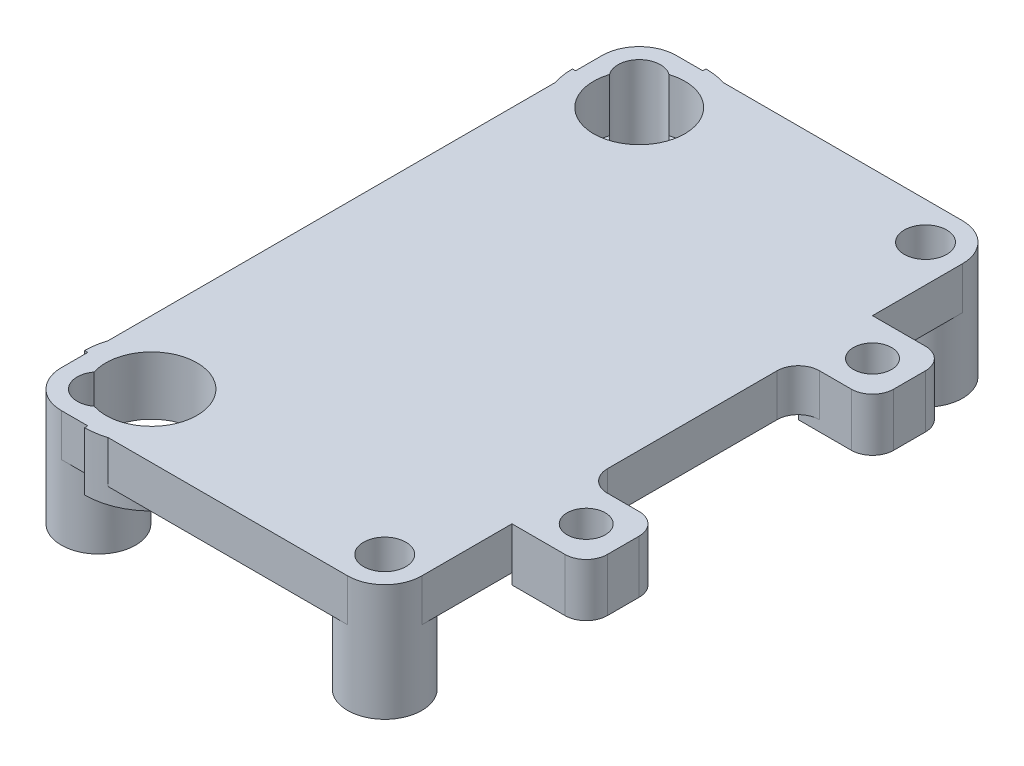
from build123d import *

# Parameters (mm, degrees)
SKETCH1_R                       = 3.5
BOSS_EXTRUDE1_DEPTH             = 11
BOSS_EXTRUDE1_2_DEPTH           = 11
BOSS_EXTRUDE1_3_DEPTH           = 11
BOSS_EXTRUDE1_4_DEPTH           = 11
BOSS_EXTRUDE2_START             = -1
BOSS_EXTRUDE2_DEPTH             = 1
F_4_0MM_DOWEL_HOLE1_D           = 4
BOSS_EXTRUDE3_START             = 3
BOSS_EXTRUDE3_DEPTH             = 3
BOSS_EXTRUDE4_REACH             = 64.845
SKETCH11_W                      = 7
SKETCH11_H                      = 7
BOSS_EXTRUDE4_DIRECTION_2_DEPTH = 1
FILLET1_R                       = 2
M3_CLEARANCE_HOLE1_D            = 3.6
SKETCH15_R                      = 4.3
CUT_EXTRUDE1_DEPTH              = 5
BOSS_EXTRUDE6_START             = -1
BOSS_EXTRUDE6_DEPTH             = 5.5


with BuildPart() as part:
    # Sketch1 → Boss-Extrude1 (new body)
    with BuildSketch(Plane(origin=(0, 0, 0), x_dir=(1, 0, 0), z_dir=(0, 1, 0))):
        with Locations(Location((0, 51, 0), (0, 0, 270))):
            Circle(SKETCH1_R)
    extrude(amount=BOSS_EXTRUDE1_DEPTH)



with BuildPart() as body_2:
    # Sketch1 → Boss-Extrude1 2 (new body)
    with BuildSketch(Plane(origin=(0, 0, 0), x_dir=(1, 0, 0), z_dir=(0, 1, 0))):
        with Locations(Location((27, 51, 0), (0, 0, 270))):
            Circle(SKETCH1_R)
    extrude(amount=BOSS_EXTRUDE1_2_DEPTH)


with BuildPart() as body_3:
    # Sketch1 → Boss-Extrude1 3 (new body)
    with BuildSketch(Plane(origin=(0, 0, 0), x_dir=(1, 0, 0), z_dir=(0, 1, 0))):
        with Locations(Location((27, 0, 0), (0, 0, 270))):
            Circle(SKETCH1_R)
    extrude(amount=BOSS_EXTRUDE1_3_DEPTH)


with BuildPart() as body_4:
    # Sketch1 → Boss-Extrude1 4 (new body)
    with BuildSketch(Plane(origin=(0, 0, 0), x_dir=(1, 0, 0), z_dir=(0, 1, 0))):
        with Locations(Location((0, 0, 0), (0, 0, 270))):
            Circle(SKETCH1_R)
    extrude(amount=BOSS_EXTRUDE1_4_DEPTH)


with BuildPart() as part_1:
    add(part.part)

    add(body_2.part)  # Boss-Extrude2 merges body 2

    add(body_3.part)  # Boss-Extrude2 merges body 3

    add(body_4.part)  # Boss-Extrude2 merges body 4
    # Sketch2 → Boss-Extrude2 (add)
    with BuildSketch(Plane(origin=(0, 11, 0), x_dir=(1, 0, 0), z_dir=(0, 1, 0)).offset(BOSS_EXTRUDE2_START)):
        with BuildLine():
            Line((27, 54.5), (0, 54.5))
            ThreePointArc((0, 54.5), (-2.474873734, 53.474873734), (-3.5, 51))
            Line((-3.5, 51), (-3.5, 0))
            ThreePointArc((-3.5, 0), (-2.474873734, -2.474873734), (0, -3.5))
            Line((0, -3.5), (27, -3.5))
            ThreePointArc((27, -3.5), (29.474873734, -2.474873734), (30.5, 0))
            Line((30.5, 0), (30.5, 51))
            ThreePointArc((30.5, 51), (29.474873734, 53.474873734), (27, 54.5))
        make_face()
    extrude(amount=BOSS_EXTRUDE2_DEPTH)

    # Ø4.0mm Dowel Hole1 (through all)
    with Locations(Plane(origin=(0, 0, 0), x_dir=(-1, 0, 0), z_dir=(0, -1, 0))):
        with Locations((-27, 51), (0, 51), (0, 0), (-27, 0)):
            Hole(F_4_0MM_DOWEL_HOLE1_D / 2)

    # Sketch10 → Boss-Extrude3 (add)
    with BuildSketch(Plane.XZ.offset(-10).offset(BOSS_EXTRUDE3_START)):
        with BuildLine():
            ThreePointArc((-3.5, -51), (-2.958039892, -49.129171307), (-1.5, -47.83772234))
            Line((-1.5, -47.83772234), (-1.5, -3.16227766))
            ThreePointArc((-1.5, -3.16227766), (-2.958039892, -1.870828693), (-3.5, 0))
            Line((-3.5, 0), (-3.5, -51))
        make_face()
        with BuildLine():
            Line((3.16227766, 1.5), (23.83772234, 1.5))
            ThreePointArc((23.83772234, 1.5), (25.129171307, 2.958039892), (27, 3.5))
            Line((27, 3.5), (0, 3.5))
            ThreePointArc((0, 3.5), (1.870828693, 2.958039892), (3.16227766, 1.5))
        make_face()
        with BuildLine():
            Line((12.36850682, -25.5), (13.5, -23.362735104))
            Line((13.5, -23.362735104), (2.453131039, -2.496427068))
            ThreePointArc((2.453131039, -2.496427068), (1.637607021, -3.093257707), (0.685555207, -3.432202508))
            Line((0.685555207, -3.432202508), (12.36850682, -25.5))
        make_face()
        with BuildLine():
            ThreePointArc((26.314444793, -3.432202508), (25.362392979, -3.093257707), (24.546868961, -2.496427068))
            Line((24.546868961, -2.496427068), (13.5, -23.362735104))
            Line((13.5, -23.362735104), (14.63149318, -25.5))
            Line((14.63149318, -25.5), (26.314444793, -3.432202508))
        make_face()
        with BuildLine():
            ThreePointArc((30.5, 0), (29.958039892, -1.870828693), (28.5, -3.16227766))
            Line((28.5, -3.16227766), (28.5, -47.83772234))
            ThreePointArc((28.5, -47.83772234), (29.958039892, -49.129171307), (30.5, -51))
            Line((30.5, -51), (30.5, 0))
        make_face()
        with BuildLine():
            ThreePointArc((27, -54.5), (25.129171307, -53.958039892), (23.83772234, -52.5))
            Line((23.83772234, -52.5), (3.16227766, -52.5))
            ThreePointArc((3.16227766, -52.5), (1.870828693, -53.958039892), (0, -54.5))
            Line((0, -54.5), (27, -54.5))
        make_face()
        Polygon((14.63149318, -25.5), (13.5, -23.362735104), (12.36850682, -25.5), (13.5, -27.637264896), align=None)
        with BuildLine():
            Line((26.314444793, -47.567797492), (14.63149318, -25.5))
            Line((14.63149318, -25.5), (13.5, -27.637264896))
            Line((13.5, -27.637264896), (24.546868961, -48.503572932))
            ThreePointArc((24.546868961, -48.503572932), (25.362392979, -47.906742293), (26.314444793, -47.567797492))
        make_face()
        with BuildLine():
            Line((13.5, -27.637264896), (12.36850682, -25.5))
            Line((12.36850682, -25.5), (0.685555207, -47.567797492))
            ThreePointArc((0.685555207, -47.567797492), (1.637607021, -47.906742293), (2.453131039, -48.503572932))
            Line((2.453131039, -48.503572932), (13.5, -27.637264896))
        make_face()
    extrude(amount=-BOSS_EXTRUDE3_DEPTH)

    # Boss-Extrude4: up to this face of the body (flat: up to its plane)
    boss_extrude4_end = Plane(part_1.part.faces().sort_by_distance((13.5, 11, -25.5))[0])
    # Sketch11 → Boss-Extrude4 (add, up to the picked face)
    with BuildSketch(Plane.XZ.offset(-7), mode=Mode.PRIVATE) as boss_extrude4_sk1:
        with Locations((34, -12)):
            Rectangle(SKETCH11_W, SKETCH11_H)
    boss_extrude4_tool1 = split(extrude(boss_extrude4_sk1.sketch, amount=-BOSS_EXTRUDE4_REACH, mode=Mode.PRIVATE), bisect_by=boss_extrude4_end, keep=Keep.BOTH, mode=Mode.PRIVATE)
    # Sketch11 → Boss-Extrude4 (add, up to the picked face)
    with BuildSketch(Plane.XZ.offset(-7), mode=Mode.PRIVATE) as boss_extrude4_sk2:
        with Locations((34, -39)):
            Rectangle(SKETCH11_W, SKETCH11_H)
    boss_extrude4_tool2 = split(extrude(boss_extrude4_sk2.sketch, amount=-BOSS_EXTRUDE4_REACH, mode=Mode.PRIVATE), bisect_by=boss_extrude4_end, keep=Keep.BOTH, mode=Mode.PRIVATE)
    add(boss_extrude4_tool1.solids().sort_by(Axis((34, 7, -12), (0, 1, 0)))[0])
    add(boss_extrude4_tool2.solids().sort_by(Axis((34, 7, -39), (0, 1, 0)))[0])

    # Sketch11 → Boss-Extrude4 direction 2 (add)
    with BuildSketch(Plane.XZ.offset(-7)):
        with Locations((34, -12)):
            Rectangle(SKETCH11_W, SKETCH11_H)
        with Locations((34, -39)):
            Rectangle(SKETCH11_W, SKETCH11_H)
    extrude(amount=BOSS_EXTRUDE4_DIRECTION_2_DEPTH)

    # Fillet1
    fillet1_edges = [part_1.edges().sort_by_distance(p)[0] for p in [
        (30.5, 9, -15.5),
        (37.5, 8.5, -15.5),
        (37.5, 8.5, -8.5),
        (30.5, 9, -35.5),
        (37.5, 8.5, -42.5),
        (37.5, 8.5, -35.5),
    ]]
    fillet(fillet1_edges, radius=FILLET1_R)

    # M3 Clearance Hole1 (through all)
    with Locations(Plane(origin=(0, 6, 0), x_dir=(-1, 0, 0), z_dir=(0, -1, 0))):
        with Locations((-34, 12), (-34, 39)):
            Hole(M3_CLEARANCE_HOLE1_D / 2)

    # Sketch15 → Cut-Extrude1 (cut)
    with BuildSketch(Plane(origin=(0, 11, 0), x_dir=(1, 0, 0), z_dir=(0, 1, 0))):
        with Locations((2.5, 48.5)):
            Circle(SKETCH15_R)
        with Locations((2.5, 2.5)):
            Circle(SKETCH15_R)
    extrude(amount=-CUT_EXTRUDE1_DEPTH, mode=Mode.SUBTRACT)

    # Sketch17 → Boss-Extrude6 (add)
    with BuildSketch(Plane.XZ.offset(-10).offset(BOSS_EXTRUDE6_START)):
        with BuildLine():
            Line((2.5, 1.8), (2.5, 3.8))
            ThreePointArc((2.5, 3.8), (6.954772721, -6.954772721), (-3.8, -2.5))
            Line((-3.8, -2.5), (-1.8, -2.5))
            ThreePointArc((-1.8, -2.5), (5.540559159, -5.540559159), (2.5, 1.8))
        make_face()
        with BuildLine():
            Line((-1.8, -48.5), (-3.8, -48.5))
            ThreePointArc((-3.8, -48.5), (6.954772721, -44.045227279), (2.5, -54.8))
            Line((2.5, -54.8), (2.5, -52.8))
            ThreePointArc((2.5, -52.8), (5.540559159, -45.459440841), (-1.8, -48.5))
        make_face()
    extrude(amount=BOSS_EXTRUDE6_DEPTH)


solid = part_1.part
